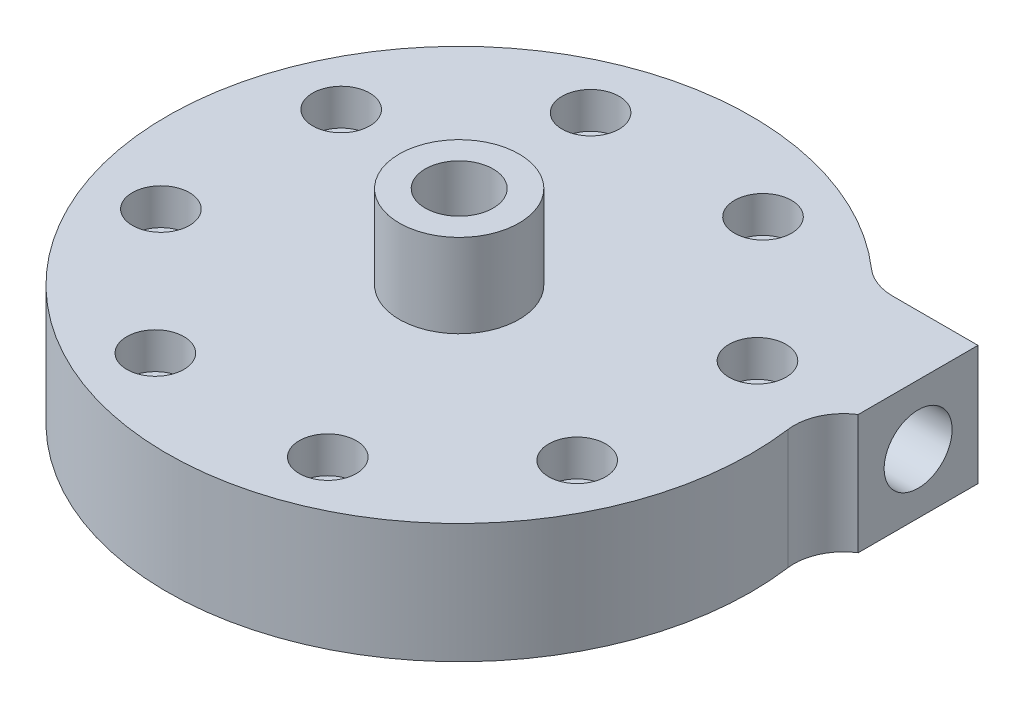
from build123d import *

# Parameters (mm, degrees)
MAIN_BODY_DEPTH           = 23.096875
SKETCH7_R                 = 25.4
INLET_BOSS_DEPTH          = 50.8
SKETCH5_R                 = 2.9765625
BOLT_CLEARANCES_DEPTH     = 86.584352336
SKETCH6_R                 = 5.5
BOLT_HEAD_CLEARANCE_DEPTH = 7


with BuildPart() as part:
    # Sketch1 → main body (new body)
    with BuildSketch(Plane(origin=(0, 0, 0), x_dir=(1, 0, 0), z_dir=(0, 1, 0))):
        with BuildLine():
            Line((60.126440201, 28.3845), (60.126440201, 39.9329375))
            Line((60.126440201, 39.9329375), (43.701872576, 39.9329375))
            ThreePointArc((43.701872576, 39.9329375), (40.184045696, 40.572120546), (37.115925876, 42.407958692))
            ThreePointArc((37.115925876, 42.407958692), (-49.641429542, -26.678744106), (55.847763546, 7.553424452))
            ThreePointArc((55.847763546, 7.553424452), (56.636518206, 12.817272415), (60.126440201, 16.8360625))
            Line((60.126440201, 16.8360625), (60.126440201, 28.3845))
        make_face()
    extrude(amount=MAIN_BODY_DEPTH)

    # Sketch7 → inlet boss (add)
    with BuildSketch(Plane(origin=(0, 23.096875, 0), x_dir=(1, 0, 0), z_dir=(0, 1, 0))):
        with Locations(Location((0, 0, 0), (0, 0, 90))):
            Circle(SKETCH7_R)
    extrude(amount=INLET_BOSS_DEPTH)

    # Sketch3 → expansion cone and outlet (revolve, cut)
    with BuildSketch(Plane(origin=(0, 11.5484375, 0), x_dir=(1, 0, 0), z_dir=(0, 1, 0))):
        Polygon((21.116967457, 30.6705), (0, 30.6705), (0, 28.3845), (2.48332197, 28.3845), (50.126440201, 28.3845), (60.126440201, 28.3845), (60.126440201, 34.9329375), (50.126440201, 34.9329375), (50.126440201, 33.2085), align=None)
    revolve(axis=Axis((50.126440201, 11.5484375, -28.3845), (-1, 0, 0)), mode=Mode.SUBTRACT)

    # Sketch2 → main chamber (revolve, cut)
    with BuildSketch(Plane.XY, mode=Mode.PRIVATE) as main_chamber_sk:
        Polygon((0, 18.681711844), (0, 9.093599728), (0, 6.593599728), (0, 0), (30.6705, 0), (30.6705, 6.593599728), (30.6705, 13.323267203), (30.6705, 13.8344375), (5.461, 19.192882141), (5.461, 29.192882141), (6.5484375, 29.192882141), (6.5484375, 39.192882141), (11.5484375, 39.192882141), (11.5484375, 23.096875), (25.4, 23.096875), (25.4, 73.896875), (0, 73.896875), (0, 39.192882141), (0, 19.192882141), align=None)
    revolve(main_chamber_sk.sketch.rotate(Axis((0, 18.681711844, 0), (0, -1, 0)), 180), axis=Axis((0, 18.681711844, 0), (0, -1, 0)), mode=Mode.SUBTRACT)

    # Sketch5 → bolt clearances (cut, through all)
    with BuildSketch(Plane(origin=(0, 23.096875, 0), x_dir=(1, 0, 0), z_dir=(0, 1, 0))):
        with Locations(Location((41.435066256, 16.091543876, 0), (0, 0, 270))):
            Circle(SKETCH5_R)
        with Locations(Location((40.677456124, -17.920576534, 0), (0, 0, 270))):
            Circle(SKETCH5_R)
        with Locations(Location((16.091543876, -41.435066256, 0), (0, 0, 270))):
            Circle(SKETCH5_R)
        with Locations(Location((-17.920576534, -40.677456124, 0), (0, 0, 270))):
            Circle(SKETCH5_R)
        with Locations(Location((-41.435066256, -16.091543876, 0), (0, 0, 270))):
            Circle(SKETCH5_R)
        with Locations(Location((-40.677456124, 17.920576534, 0), (0, 0, 270))):
            Circle(SKETCH5_R)
        with Locations(Location((-16.091543876, 41.435066256, 0), (0, 0, 270))):
            Circle(SKETCH5_R)
        with Locations(Location((17.920576534, 40.677456124, 0), (0, 0, 270))):
            Circle(SKETCH5_R)
    extrude(amount=-BOLT_CLEARANCES_DEPTH, mode=Mode.SUBTRACT)

    # Sketch6 → bolt head clearance (cut)
    with BuildSketch(Plane(origin=(0, 23.096875, 0), x_dir=(1, 0, 0), z_dir=(0, 1, 0))):
        with Locations(Location((41.435066256, 16.091543876, 0), (0, 0, 270))):
            Circle(SKETCH6_R)
        with Locations(Location((40.677456124, -17.920576534, 0), (0, 0, 270))):
            Circle(SKETCH6_R)
        with Locations(Location((16.091543876, -41.435066256, 0), (0, 0, 270))):
            Circle(SKETCH6_R)
        with Locations(Location((-17.920576534, -40.677456124, 0), (0, 0, 270))):
            Circle(SKETCH6_R)
        with Locations(Location((-41.435066256, -16.091543876, 0), (0, 0, 270))):
            Circle(SKETCH6_R)
        with Locations(Location((-40.677456124, 17.920576534, 0), (0, 0, 270))):
            Circle(SKETCH6_R)
        with Locations(Location((-16.091543876, 41.435066256, 0), (0, 0, 270))):
            Circle(SKETCH6_R)
        with Locations(Location((17.920576534, 40.677456124, 0), (0, 0, 270))):
            Circle(SKETCH6_R)
    extrude(amount=-BOLT_HEAD_CLEARANCE_DEPTH, mode=Mode.SUBTRACT)


solid = part.part
